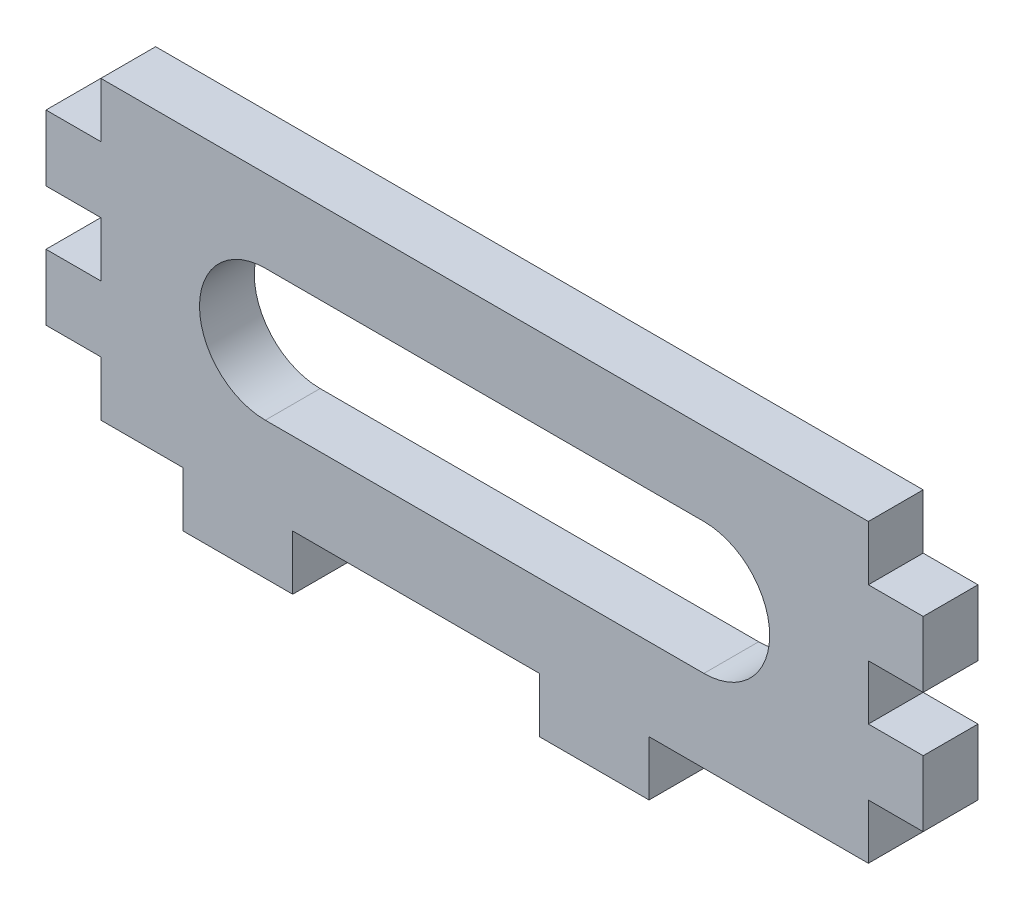
from build123d import *

# Parameters (mm, degrees)
ESQUISSE1_W        = 80
ESQUISSE1_H        = 27
BOSS_EXTRU_1_DEPTH = 5
ESQUISSE2_W        = 5
ESQUISSE2_H        = 5
CR_NEAUX_DEPTH     = 5
ESQUISSE3_W        = 10
ESQUISSE3_H        = 5
BOSS_EXTRU_2_DEPTH = 5


with BuildPart() as part:
    # Esquisse1 → Boss.-Extru.1 (new body)
    with BuildSketch(Plane.XY):
        with Locations((161.17461402, 156.921111622)):
            Rectangle(ESQUISSE1_W, ESQUISSE1_H)
    extrude(amount=-BOSS_EXTRU_1_DEPTH)

    # Esquisse2 → Créneaux - (cut)
    with BuildSketch(Plane.XY):
        with Locations((123.67461402, 167.921111622)):
            Rectangle(ESQUISSE2_W, ESQUISSE2_H)
        with Locations((123.67461402, 156.921111622)):
            Rectangle(ESQUISSE2_W, ESQUISSE2_H)
        with Locations((123.67461402, 145.921111622)):
            Rectangle(ESQUISSE2_W, ESQUISSE2_H)
        with Locations((198.67461402, 145.921111622)):
            Rectangle(ESQUISSE2_W, ESQUISSE2_H)
        with Locations((198.67461402, 156.921111622)):
            Rectangle(ESQUISSE2_W, ESQUISSE2_H)
        with Locations((198.67461402, 167.921111622)):
            Rectangle(ESQUISSE2_W, ESQUISSE2_H)
        with BuildLine():
            Line((141.17461402, 162.921111622), (181.17461402, 162.921111622))
            ThreePointArc((181.17461402, 162.921111622), (187.17461402, 156.921111622), (181.17461402, 150.921111622))
            Line((181.17461402, 150.921111622), (141.17461402, 150.921111622))
            ThreePointArc((141.17461402, 150.921111622), (135.17461402, 156.921111622), (141.17461402, 162.921111622))
        make_face()
    extrude(amount=-CR_NEAUX_DEPTH, mode=Mode.SUBTRACT)

    # Esquisse3 → Boss.-Extru.2 (add)
    with BuildSketch(Plane.XY):
        with Locations((138.67461402, 140.921111622)):
            Rectangle(ESQUISSE3_W, ESQUISSE3_H)
        with Locations((171.17461402, 140.921111622)):
            Rectangle(ESQUISSE3_W, ESQUISSE3_H)
    extrude(amount=-BOSS_EXTRU_2_DEPTH)


solid = part.part
